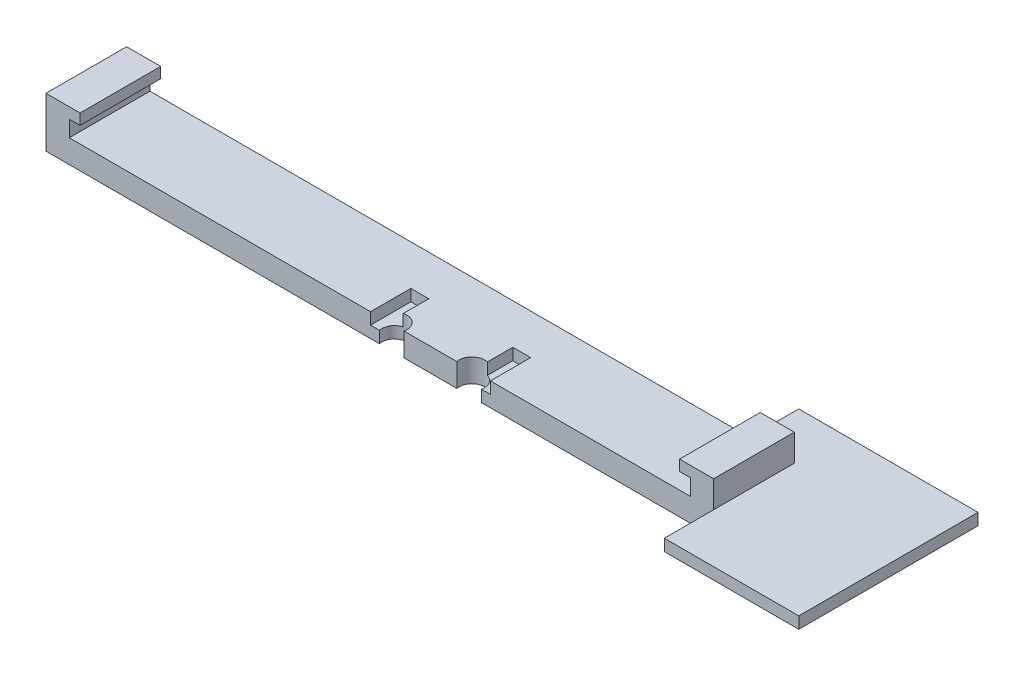
from build123d import *

# Parameters (mm, degrees)
BOSS_EXTRUDE1_DEPTH = 3.302
SKETCH2_W           = 11.43
SKETCH2_H           = 7.112
BOSS_EXTRUDE2_DEPTH = 3.302
SKETCH3_W           = 11.43
SKETCH3_H           = 7.112
BOSS_EXTRUDE3_DEPTH = 3.302
SKETCH4_W           = 1.524
SKETCH4_H           = 11.43
BOSS_EXTRUDE4_DEPTH = 1.524
SKETCH5_W           = 1.524
SKETCH5_H           = 11.43
BOSS_EXTRUDE5_DEPTH = 1.524
SKETCH7_W           = 2.54
SKETCH7_H           = 5.715
CUT_EXTRUDE1_DEPTH  = 1.651
BOSS_EXTRUDE8_START = -3.302
BOSS_EXTRUDE8_DEPTH = 1.651


with BuildPart() as part:
    # Sketch1 → Boss-Extrude1 (new body)
    with BuildSketch(Plane(origin=(0, 0, 0), x_dir=(1, 0, 0), z_dir=(0, 1, 0))):
        with BuildLine():
            Line((-29.60690112, 0), (0, 0))
            Line((0, 0), (0, 11.43))
            Line((0, 11.43), (-88.011, 11.43))
            Line((-88.011, 11.43), (-88.011, 0))
            Line((-88.011, 0), (-44.05309888, 0))
            ThreePointArc((-44.05309888, 0), (-42.508016011, 2.148644564), (-40.5384, 0.381))
            ThreePointArc((-40.5384, 0.381), (-40.548755436, 0.189383989), (-40.57970112, 0))
            Line((-40.57970112, 0), (-33.08029888, 0))
            ThreePointArc((-33.08029888, 0), (-31.535216011, 2.148644564), (-29.5656, 0.381))
            ThreePointArc((-29.5656, 0.381), (-29.575955436, 0.189383989), (-29.60690112, 0))
        make_face()
    extrude(amount=BOSS_EXTRUDE1_DEPTH)

    # Sketch2 → Boss-Extrude2 (add)
    with BuildSketch(Plane(origin=(0, 0, 0), x_dir=(0, 0, -1), z_dir=(1, 0, 0))):
        with Locations((5.715, 3.556)):
            Rectangle(SKETCH2_W, SKETCH2_H)
    extrude(amount=BOSS_EXTRUDE2_DEPTH)

    # Sketch3 → Boss-Extrude3 (add)
    with BuildSketch(Plane.ZY.offset(88.011)):
        with Locations((-5.715, 3.556)):
            Rectangle(SKETCH3_W, SKETCH3_H)
    extrude(amount=BOSS_EXTRUDE3_DEPTH)

    # Sketch4 → Boss-Extrude4 (add)
    with BuildSketch(Plane(origin=(0, 7.112, 0), x_dir=(1, 0, 0), z_dir=(0, 1, 0))):
        with Locations((-87.249, 5.715)):
            Rectangle(SKETCH4_W, SKETCH4_H)
    extrude(amount=-BOSS_EXTRUDE4_DEPTH)

    # Sketch5 → Boss-Extrude5 (add)
    with BuildSketch(Plane(origin=(0, 7.112, 0), x_dir=(1, 0, 0), z_dir=(0, 1, 0))):
        with Locations((-0.762, 5.715)):
            Rectangle(SKETCH5_W, SKETCH5_H)
    extrude(amount=-BOSS_EXTRUDE5_DEPTH)

    # Sketch7 → Cut-Extrude1 (cut)
    with BuildSketch(Plane(origin=(0, 3.302, 0), x_dir=(1, 0, 0), z_dir=(0, 1, 0))):
        with Locations((-44.05309888, 2.8575)):
            Rectangle(SKETCH7_W, SKETCH7_H)
        with Locations((-29.60690112, 2.8575)):
            Rectangle(SKETCH7_W, SKETCH7_H)
    extrude(amount=-CUT_EXTRUDE1_DEPTH, mode=Mode.SUBTRACT)

    # Sketch9 → Boss-Extrude8 (add)
    with BuildSketch(Plane.XZ.offset(BOSS_EXTRUDE8_START)):
        Polygon((-3.048, -11.43), (-3.048, -18.415), (22.352, -18.415), (22.352, 6.985), (3.302, 6.985), (3.302, 0), (3.302, -11.43), align=None)
    extrude(amount=BOSS_EXTRUDE8_DEPTH)


solid = part.part
